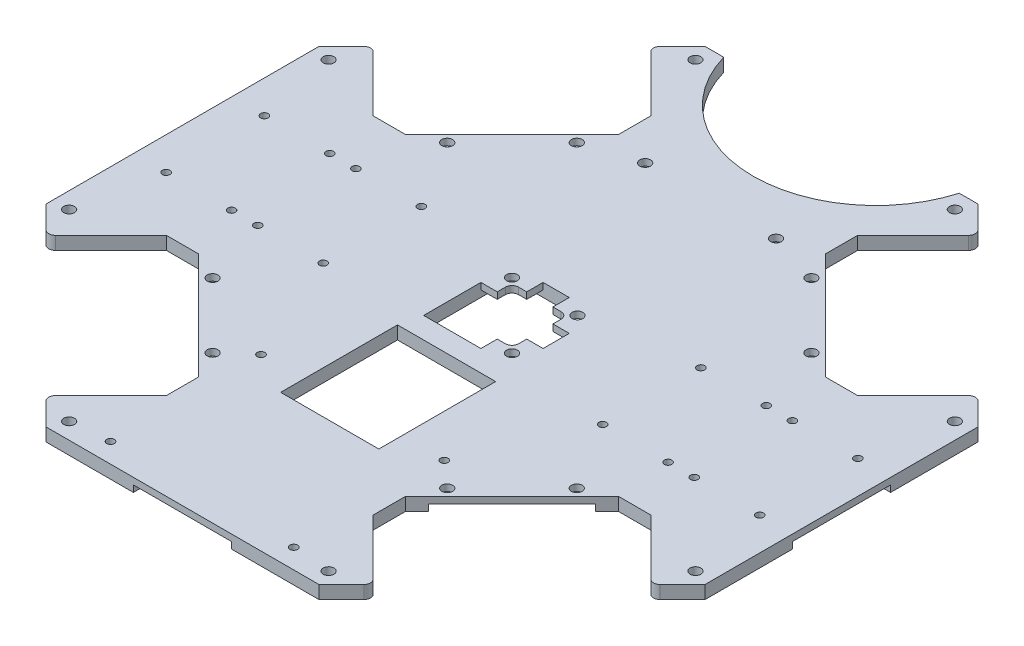
from build123d import *

# Parameters (mm, degrees)
BOSS_EXTRUDE1_DEPTH = 4
CUT_EXTRUDE1_REACH  = 144.472
SKETCH2_R           = 1.65
CUT_EXTRUDE2_REACH  = 144.472
SKETCH3_R           = 37.5
CHAMFER2_SIZE       = 7
CUT_EXTRUDE3_REACH  = 144.472
SKETCH4_R           = 1.65
CUT_EXTRUDE4_REACH  = 144.472
SKETCH5_R           = 1.15
CUT_EXTRUDE5_DEPTH  = 2
CUT_EXTRUDE6_DEPTH  = 2
CUT_EXTRUDE7_REACH  = 144.472
SKETCH8_R           = 1.65
CUT_EXTRUDE9_REACH  = 144.472
SKETCH10_W          = 8
SKETCH10_H          = 5
SKETCH10_W_2        = 5
SKETCH10_H_2        = 8
CUT_EXTRUDE10_REACH = 144.472
SKETCH11_R          = 1.65
CUT_EXTRUDE11_REACH = 144.472
SKETCH12_W          = 30
SKETCH12_H          = 35.702869044
SKETCH13_W          = 30
SKETCH13_H          = 40
SKETCH13_W_2        = 50
SKETCH13_H_2        = 30
SKETCH13_H_3        = 45
CUT_EXTRUDE12_DEPTH = 2
SKETCH15_R          = 4
CUT_EXTRUDE13_DEPTH = 2
CUT_EXTRUDE14_REACH = 144.472
SKETCH16_R          = 1.15
SKETCH17_R          = 2.5
CUT_EXTRUDE16_DEPTH = 2
SKETCH18_W          = 27
SKETCH18_H          = 27
CUT_EXTRUDE17_DEPTH = 2
CUT_EXTRUDE19_REACH = 144.429
SKETCH19_W          = 9.5
SKETCH19_H          = 9.5
CUT_EXTRUDE20_DEPTH = 2
FILLET1_R           = 2


with BuildPart() as part:
    # Sketch1 → Boss-Extrude1 (new body)
    with BuildSketch(Plane(origin=(0, 0, 0), x_dir=(1, 0, 0), z_dir=(0, 1, 0))):
        Polygon((-41.712494128, 100.702869044), (-100.702869044, 41.712494128), (-100.702869044, -41.712494128), (-41.712494128, -100.702869044), (41.712494128, -100.702869044), (100.702869044, -41.712494128), (100.702869044, 41.712494128), (41.712494128, 100.702869044), align=None)
    extrude(amount=BOSS_EXTRUDE1_DEPTH)

    # Sketch2 → Cut-Extrude1 (cut, up to next)
    with BuildSketch(Plane(origin=(0, 4, 0), x_dir=(1, 0, 0), z_dir=(0, 1, 0)), mode=Mode.PRIVATE) as cut_extrude1_sk1:
        with Locations(Location((-55.6513324, 35.852342526, 0), (0, 0, 270))):
            Circle(SKETCH2_R)
    cut_extrude1_tool1 = extrude(cut_extrude1_sk1.sketch, amount=-CUT_EXTRUDE1_REACH, mode=Mode.PRIVATE) & part.part
    # Sketch2 → Cut-Extrude1 (cut, up to next)
    with BuildSketch(Plane(origin=(0, 4, 0), x_dir=(1, 0, 0), z_dir=(0, 1, 0)), mode=Mode.PRIVATE) as cut_extrude1_sk2:
        with Locations(Location((-35.852342526, 55.6513324, 0), (0, 0, 270))):
            Circle(SKETCH2_R)
    cut_extrude1_tool2 = extrude(cut_extrude1_sk2.sketch, amount=-CUT_EXTRUDE1_REACH, mode=Mode.PRIVATE) & part.part
    # Sketch2 → Cut-Extrude1 (cut, up to next)
    with BuildSketch(Plane(origin=(0, 4, 0), x_dir=(1, 0, 0), z_dir=(0, 1, 0)), mode=Mode.PRIVATE) as cut_extrude1_sk3:
        with Locations(Location((55.6513324, 35.852342526, 0), (0, 0, 270))):
            Circle(SKETCH2_R)
    cut_extrude1_tool3 = extrude(cut_extrude1_sk3.sketch, amount=-CUT_EXTRUDE1_REACH, mode=Mode.PRIVATE) & part.part
    # Sketch2 → Cut-Extrude1 (cut, up to next)
    with BuildSketch(Plane(origin=(0, 4, 0), x_dir=(1, 0, 0), z_dir=(0, 1, 0)), mode=Mode.PRIVATE) as cut_extrude1_sk4:
        with Locations(Location((35.852342526, 55.6513324, 0), (0, 0, 270))):
            Circle(SKETCH2_R)
    cut_extrude1_tool4 = extrude(cut_extrude1_sk4.sketch, amount=-CUT_EXTRUDE1_REACH, mode=Mode.PRIVATE) & part.part
    # Sketch2 → Cut-Extrude1 (cut, up to next)
    with BuildSketch(Plane(origin=(0, 4, 0), x_dir=(1, 0, 0), z_dir=(0, 1, 0)), mode=Mode.PRIVATE) as cut_extrude1_sk5:
        with Locations(Location((35.852342526, -55.6513324, 0), (0, 0, 270))):
            Circle(SKETCH2_R)
    cut_extrude1_tool5 = extrude(cut_extrude1_sk5.sketch, amount=-CUT_EXTRUDE1_REACH, mode=Mode.PRIVATE) & part.part
    # Sketch2 → Cut-Extrude1 (cut, up to next)
    with BuildSketch(Plane(origin=(0, 4, 0), x_dir=(1, 0, 0), z_dir=(0, 1, 0)), mode=Mode.PRIVATE) as cut_extrude1_sk6:
        with Locations(Location((55.6513324, -35.852342526, 0), (0, 0, 270))):
            Circle(SKETCH2_R)
    cut_extrude1_tool6 = extrude(cut_extrude1_sk6.sketch, amount=-CUT_EXTRUDE1_REACH, mode=Mode.PRIVATE) & part.part
    # Sketch2 → Cut-Extrude1 (cut, up to next)
    with BuildSketch(Plane(origin=(0, 4, 0), x_dir=(1, 0, 0), z_dir=(0, 1, 0)), mode=Mode.PRIVATE) as cut_extrude1_sk7:
        with Locations(Location((-55.6513324, -35.852342526, 0), (0, 0, 270))):
            Circle(SKETCH2_R)
    cut_extrude1_tool7 = extrude(cut_extrude1_sk7.sketch, amount=-CUT_EXTRUDE1_REACH, mode=Mode.PRIVATE) & part.part
    # Sketch2 → Cut-Extrude1 (cut, up to next)
    with BuildSketch(Plane(origin=(0, 4, 0), x_dir=(1, 0, 0), z_dir=(0, 1, 0)), mode=Mode.PRIVATE) as cut_extrude1_sk8:
        with Locations(Location((-35.852342526, -55.6513324, 0), (0, 0, 270))):
            Circle(SKETCH2_R)
    cut_extrude1_tool8 = extrude(cut_extrude1_sk8.sketch, amount=-CUT_EXTRUDE1_REACH, mode=Mode.PRIVATE) & part.part
    # Sketch2 → Cut-Extrude1 (cut, up to next)
    with BuildSketch(Plane(origin=(0, 4, 0), x_dir=(1, 0, 0), z_dir=(0, 1, 0)), mode=Mode.PRIVATE) as cut_extrude1_sk9:
        Polygon((-92.420885021, 49.99447815), (-49.99447815, 92.420885021), (-26.659954371, 69.086361242), (-69.086361242, 26.659954371), align=None)
    cut_extrude1_tool9 = extrude(cut_extrude1_sk9.sketch, amount=-CUT_EXTRUDE1_REACH, mode=Mode.PRIVATE) & part.part
    # Sketch2 → Cut-Extrude1 (cut, up to next)
    with BuildSketch(Plane(origin=(0, 4, 0), x_dir=(1, 0, 0), z_dir=(0, 1, 0)), mode=Mode.PRIVATE) as cut_extrude1_sk10:
        Polygon((49.99447815, 92.420885021), (92.420885021, 49.99447815), (69.086361242, 26.659954371), (26.659954371, 69.086361242), align=None)
    cut_extrude1_tool10 = extrude(cut_extrude1_sk10.sketch, amount=-CUT_EXTRUDE1_REACH, mode=Mode.PRIVATE) & part.part
    # Sketch2 → Cut-Extrude1 (cut, up to next)
    with BuildSketch(Plane(origin=(0, 4, 0), x_dir=(1, 0, 0), z_dir=(0, 1, 0)), mode=Mode.PRIVATE) as cut_extrude1_sk11:
        Polygon((92.420885021, -49.99447815), (49.99447815, -92.420885021), (26.659954371, -69.086361242), (69.086361242, -26.659954371), align=None)
    cut_extrude1_tool11 = extrude(cut_extrude1_sk11.sketch, amount=-CUT_EXTRUDE1_REACH, mode=Mode.PRIVATE) & part.part
    # Sketch2 → Cut-Extrude1 (cut, up to next)
    with BuildSketch(Plane(origin=(0, 4, 0), x_dir=(1, 0, 0), z_dir=(0, 1, 0)), mode=Mode.PRIVATE) as cut_extrude1_sk12:
        Polygon((-49.99447815, -92.420885021), (-92.420885021, -49.99447815), (-69.086361242, -26.659954371), (-26.659954371, -69.086361242), align=None)
    cut_extrude1_tool12 = extrude(cut_extrude1_sk12.sketch, amount=-CUT_EXTRUDE1_REACH, mode=Mode.PRIVATE) & part.part
    add(cut_extrude1_tool1.solids().sort_by_distance((-55.651332, 4, -35.852343))[0], mode=Mode.SUBTRACT)
    add(cut_extrude1_tool2.solids().sort_by_distance((-35.852343, 4, -55.651332))[0], mode=Mode.SUBTRACT)
    add(cut_extrude1_tool3.solids().sort_by_distance((55.651332, 4, -35.852343))[0], mode=Mode.SUBTRACT)
    add(cut_extrude1_tool4.solids().sort_by_distance((35.852343, 4, -55.651332))[0], mode=Mode.SUBTRACT)
    add(cut_extrude1_tool5.solids().sort_by_distance((35.852343, 4, 55.651332))[0], mode=Mode.SUBTRACT)
    add(cut_extrude1_tool6.solids().sort_by_distance((55.651332, 4, 35.852343))[0], mode=Mode.SUBTRACT)
    add(cut_extrude1_tool7.solids().sort_by_distance((-55.651332, 4, 35.852343))[0], mode=Mode.SUBTRACT)
    add(cut_extrude1_tool8.solids().sort_by_distance((-35.852343, 4, 55.651332))[0], mode=Mode.SUBTRACT)
    add(cut_extrude1_tool9.solids().sort_by_distance((-59.54042, 4, -59.54042))[0], mode=Mode.SUBTRACT)
    add(cut_extrude1_tool10.solids().sort_by_distance((59.54042, 4, -59.54042))[0], mode=Mode.SUBTRACT)
    add(cut_extrude1_tool11.solids().sort_by_distance((59.54042, 4, 59.54042))[0], mode=Mode.SUBTRACT)
    add(cut_extrude1_tool12.solids().sort_by_distance((-59.54042, 4, 59.54042))[0], mode=Mode.SUBTRACT)

    # Sketch3 → Cut-Extrude2 (cut, up to next)
    with BuildSketch(Plane(origin=(0, 4, 0), x_dir=(1, 0, 0), z_dir=(0, 1, 0)), mode=Mode.PRIVATE) as cut_extrude2_sk1:
        with Locations((0, 111.202869044)):
            Circle(SKETCH3_R)
    cut_extrude2_tool1 = extrude(cut_extrude2_sk1.sketch, amount=-CUT_EXTRUDE2_REACH, mode=Mode.PRIVATE) & part.part
    add(cut_extrude2_tool1.solids().sort_by_distance((0, 4, -111.202869))[0], mode=Mode.SUBTRACT)

    # Chamfer2
    chamfer2_edges = [part.edges().sort_by_distance(p)[0] for p in [
        (69.086361242, 2, 26.659954371),
        (26.659954371, 2, 69.086361242),
        (26.659954371, 2, -69.086361242),
        (69.086361242, 2, -26.659954371),
        (-26.659954371, 2, 69.086361242),
        (-69.086361242, 2, 26.659954371),
        (-69.086361242, 2, -26.659954371),
        (-26.659954371, 2, -69.086361242),
    ]]
    chamfer(chamfer2_edges, length=CHAMFER2_SIZE)

    # Sketch4 → Cut-Extrude3 (cut, up to next)
    with BuildSketch(Plane(origin=(0, 4, 0), x_dir=(1, 0, 0), z_dir=(0, 1, 0)), mode=Mode.PRIVATE) as cut_extrude3_sk1:
        with Locations(Location((-39.641426316, 95.702869044, 0), (0, 0, 270))):
            Circle(SKETCH4_R)
    cut_extrude3_tool1 = extrude(cut_extrude3_sk1.sketch, amount=-CUT_EXTRUDE3_REACH, mode=Mode.PRIVATE) & part.part
    # Sketch4 → Cut-Extrude3 (cut, up to next)
    with BuildSketch(Plane(origin=(0, 4, 0), x_dir=(1, 0, 0), z_dir=(0, 1, 0)), mode=Mode.PRIVATE) as cut_extrude3_sk2:
        with Locations(Location((39.641426316, 95.702869044, 0), (0, 0, 270))):
            Circle(SKETCH4_R)
    cut_extrude3_tool2 = extrude(cut_extrude3_sk2.sketch, amount=-CUT_EXTRUDE3_REACH, mode=Mode.PRIVATE) & part.part
    # Sketch4 → Cut-Extrude3 (cut, up to next)
    with BuildSketch(Plane(origin=(0, 4, 0), x_dir=(1, 0, 0), z_dir=(0, 1, 0)), mode=Mode.PRIVATE) as cut_extrude3_sk3:
        with Locations(Location((95.702869044, 39.641426316, 0), (0, 0, 270))):
            Circle(SKETCH4_R)
    cut_extrude3_tool3 = extrude(cut_extrude3_sk3.sketch, amount=-CUT_EXTRUDE3_REACH, mode=Mode.PRIVATE) & part.part
    # Sketch4 → Cut-Extrude3 (cut, up to next)
    with BuildSketch(Plane(origin=(0, 4, 0), x_dir=(1, 0, 0), z_dir=(0, 1, 0)), mode=Mode.PRIVATE) as cut_extrude3_sk4:
        with Locations(Location((95.702869044, -39.641426316, 0), (0, 0, 270))):
            Circle(SKETCH4_R)
    cut_extrude3_tool4 = extrude(cut_extrude3_sk4.sketch, amount=-CUT_EXTRUDE3_REACH, mode=Mode.PRIVATE) & part.part
    # Sketch4 → Cut-Extrude3 (cut, up to next)
    with BuildSketch(Plane(origin=(0, 4, 0), x_dir=(1, 0, 0), z_dir=(0, 1, 0)), mode=Mode.PRIVATE) as cut_extrude3_sk5:
        with Locations(Location((39.641426316, -95.702869044, 0), (0, 0, 270))):
            Circle(SKETCH4_R)
    cut_extrude3_tool5 = extrude(cut_extrude3_sk5.sketch, amount=-CUT_EXTRUDE3_REACH, mode=Mode.PRIVATE) & part.part
    # Sketch4 → Cut-Extrude3 (cut, up to next)
    with BuildSketch(Plane(origin=(0, 4, 0), x_dir=(1, 0, 0), z_dir=(0, 1, 0)), mode=Mode.PRIVATE) as cut_extrude3_sk6:
        with Locations(Location((-39.641426316, -95.702869044, 0), (0, 0, 270))):
            Circle(SKETCH4_R)
    cut_extrude3_tool6 = extrude(cut_extrude3_sk6.sketch, amount=-CUT_EXTRUDE3_REACH, mode=Mode.PRIVATE) & part.part
    # Sketch4 → Cut-Extrude3 (cut, up to next)
    with BuildSketch(Plane(origin=(0, 4, 0), x_dir=(1, 0, 0), z_dir=(0, 1, 0)), mode=Mode.PRIVATE) as cut_extrude3_sk7:
        with Locations(Location((-95.702869044, -39.641426316, 0), (0, 0, 270))):
            Circle(SKETCH4_R)
    cut_extrude3_tool7 = extrude(cut_extrude3_sk7.sketch, amount=-CUT_EXTRUDE3_REACH, mode=Mode.PRIVATE) & part.part
    # Sketch4 → Cut-Extrude3 (cut, up to next)
    with BuildSketch(Plane(origin=(0, 4, 0), x_dir=(1, 0, 0), z_dir=(0, 1, 0)), mode=Mode.PRIVATE) as cut_extrude3_sk8:
        with Locations(Location((-95.702869044, 39.641426316, 0), (0, 0, 270))):
            Circle(SKETCH4_R)
    cut_extrude3_tool8 = extrude(cut_extrude3_sk8.sketch, amount=-CUT_EXTRUDE3_REACH, mode=Mode.PRIVATE) & part.part
    add(cut_extrude3_tool1.solids().sort_by_distance((-39.641426, 4, -95.702869))[0], mode=Mode.SUBTRACT)
    add(cut_extrude3_tool2.solids().sort_by_distance((39.641426, 4, -95.702869))[0], mode=Mode.SUBTRACT)
    add(cut_extrude3_tool3.solids().sort_by_distance((95.702869, 4, -39.641426))[0], mode=Mode.SUBTRACT)
    add(cut_extrude3_tool4.solids().sort_by_distance((95.702869, 4, 39.641426))[0], mode=Mode.SUBTRACT)
    add(cut_extrude3_tool5.solids().sort_by_distance((39.641426, 4, 95.702869))[0], mode=Mode.SUBTRACT)
    add(cut_extrude3_tool6.solids().sort_by_distance((-39.641426, 4, 95.702869))[0], mode=Mode.SUBTRACT)
    add(cut_extrude3_tool7.solids().sort_by_distance((-95.702869, 4, 39.641426))[0], mode=Mode.SUBTRACT)
    add(cut_extrude3_tool8.solids().sort_by_distance((-95.702869, 4, -39.641426))[0], mode=Mode.SUBTRACT)

    # Sketch5 → Cut-Extrude4 (cut, up to next)
    with BuildSketch(Plane(origin=(0, 4, 0), x_dir=(1, 0, 0), z_dir=(0, 1, 0)), mode=Mode.PRIVATE) as cut_extrude4_sk1:
        with Locations(Location((-90.702869044, 15, 0), (0, 0, 270))):
            Circle(SKETCH5_R)
    cut_extrude4_tool1 = extrude(cut_extrude4_sk1.sketch, amount=-CUT_EXTRUDE4_REACH, mode=Mode.PRIVATE) & part.part
    # Sketch5 → Cut-Extrude4 (cut, up to next)
    with BuildSketch(Plane(origin=(0, 4, 0), x_dir=(1, 0, 0), z_dir=(0, 1, 0)), mode=Mode.PRIVATE) as cut_extrude4_sk2:
        with Locations(Location((-70.702869044, 15, 0), (0, 0, 270))):
            Circle(SKETCH5_R)
    cut_extrude4_tool2 = extrude(cut_extrude4_sk2.sketch, amount=-CUT_EXTRUDE4_REACH, mode=Mode.PRIVATE) & part.part
    # Sketch5 → Cut-Extrude4 (cut, up to next)
    with BuildSketch(Plane(origin=(0, 4, 0), x_dir=(1, 0, 0), z_dir=(0, 1, 0)), mode=Mode.PRIVATE) as cut_extrude4_sk3:
        with Locations(Location((-62.702869044, 15, 0), (0, 0, 270))):
            Circle(SKETCH5_R)
    cut_extrude4_tool3 = extrude(cut_extrude4_sk3.sketch, amount=-CUT_EXTRUDE4_REACH, mode=Mode.PRIVATE) & part.part
    # Sketch5 → Cut-Extrude4 (cut, up to next)
    with BuildSketch(Plane(origin=(0, 4, 0), x_dir=(1, 0, 0), z_dir=(0, 1, 0)), mode=Mode.PRIVATE) as cut_extrude4_sk4:
        with Locations(Location((-42.702869044, 15, 0), (0, 0, 270))):
            Circle(SKETCH5_R)
    cut_extrude4_tool4 = extrude(cut_extrude4_sk4.sketch, amount=-CUT_EXTRUDE4_REACH, mode=Mode.PRIVATE) & part.part
    # Sketch5 → Cut-Extrude4 (cut, up to next)
    with BuildSketch(Plane(origin=(0, 4, 0), x_dir=(1, 0, 0), z_dir=(0, 1, 0)), mode=Mode.PRIVATE) as cut_extrude4_sk5:
        with Locations(Location((-42.702869044, -15, 0), (0, 0, 270))):
            Circle(SKETCH5_R)
    cut_extrude4_tool5 = extrude(cut_extrude4_sk5.sketch, amount=-CUT_EXTRUDE4_REACH, mode=Mode.PRIVATE) & part.part
    # Sketch5 → Cut-Extrude4 (cut, up to next)
    with BuildSketch(Plane(origin=(0, 4, 0), x_dir=(1, 0, 0), z_dir=(0, 1, 0)), mode=Mode.PRIVATE) as cut_extrude4_sk6:
        with Locations(Location((-62.702869044, -15, 0), (0, 0, 270))):
            Circle(SKETCH5_R)
    cut_extrude4_tool6 = extrude(cut_extrude4_sk6.sketch, amount=-CUT_EXTRUDE4_REACH, mode=Mode.PRIVATE) & part.part
    # Sketch5 → Cut-Extrude4 (cut, up to next)
    with BuildSketch(Plane(origin=(0, 4, 0), x_dir=(1, 0, 0), z_dir=(0, 1, 0)), mode=Mode.PRIVATE) as cut_extrude4_sk7:
        with Locations(Location((-70.702869044, -15, 0), (0, 0, 270))):
            Circle(SKETCH5_R)
    cut_extrude4_tool7 = extrude(cut_extrude4_sk7.sketch, amount=-CUT_EXTRUDE4_REACH, mode=Mode.PRIVATE) & part.part
    # Sketch5 → Cut-Extrude4 (cut, up to next)
    with BuildSketch(Plane(origin=(0, 4, 0), x_dir=(1, 0, 0), z_dir=(0, 1, 0)), mode=Mode.PRIVATE) as cut_extrude4_sk8:
        with Locations(Location((-90.702869044, -15, 0), (0, 0, 270))):
            Circle(SKETCH5_R)
    cut_extrude4_tool8 = extrude(cut_extrude4_sk8.sketch, amount=-CUT_EXTRUDE4_REACH, mode=Mode.PRIVATE) & part.part
    # Sketch5 → Cut-Extrude4 (cut, up to next)
    with BuildSketch(Plane(origin=(0, 4, 0), x_dir=(1, 0, 0), z_dir=(0, 1, 0)), mode=Mode.PRIVATE) as cut_extrude4_sk9:
        with Locations(Location((90.702869044, -15, 0), (0, 0, 270))):
            Circle(SKETCH5_R)
    cut_extrude4_tool9 = extrude(cut_extrude4_sk9.sketch, amount=-CUT_EXTRUDE4_REACH, mode=Mode.PRIVATE) & part.part
    # Sketch5 → Cut-Extrude4 (cut, up to next)
    with BuildSketch(Plane(origin=(0, 4, 0), x_dir=(1, 0, 0), z_dir=(0, 1, 0)), mode=Mode.PRIVATE) as cut_extrude4_sk10:
        with Locations(Location((70.702869044, -15, 0), (0, 0, 270))):
            Circle(SKETCH5_R)
    cut_extrude4_tool10 = extrude(cut_extrude4_sk10.sketch, amount=-CUT_EXTRUDE4_REACH, mode=Mode.PRIVATE) & part.part
    # Sketch5 → Cut-Extrude4 (cut, up to next)
    with BuildSketch(Plane(origin=(0, 4, 0), x_dir=(1, 0, 0), z_dir=(0, 1, 0)), mode=Mode.PRIVATE) as cut_extrude4_sk11:
        with Locations(Location((62.702869044, -15, 0), (0, 0, 270))):
            Circle(SKETCH5_R)
    cut_extrude4_tool11 = extrude(cut_extrude4_sk11.sketch, amount=-CUT_EXTRUDE4_REACH, mode=Mode.PRIVATE) & part.part
    # Sketch5 → Cut-Extrude4 (cut, up to next)
    with BuildSketch(Plane(origin=(0, 4, 0), x_dir=(1, 0, 0), z_dir=(0, 1, 0)), mode=Mode.PRIVATE) as cut_extrude4_sk12:
        with Locations(Location((42.702869044, -15, 0), (0, 0, 270))):
            Circle(SKETCH5_R)
    cut_extrude4_tool12 = extrude(cut_extrude4_sk12.sketch, amount=-CUT_EXTRUDE4_REACH, mode=Mode.PRIVATE) & part.part
    # Sketch5 → Cut-Extrude4 (cut, up to next)
    with BuildSketch(Plane(origin=(0, 4, 0), x_dir=(1, 0, 0), z_dir=(0, 1, 0)), mode=Mode.PRIVATE) as cut_extrude4_sk13:
        with Locations(Location((42.702869044, 15, 0), (0, 0, 270))):
            Circle(SKETCH5_R)
    cut_extrude4_tool13 = extrude(cut_extrude4_sk13.sketch, amount=-CUT_EXTRUDE4_REACH, mode=Mode.PRIVATE) & part.part
    # Sketch5 → Cut-Extrude4 (cut, up to next)
    with BuildSketch(Plane(origin=(0, 4, 0), x_dir=(1, 0, 0), z_dir=(0, 1, 0)), mode=Mode.PRIVATE) as cut_extrude4_sk14:
        with Locations(Location((62.702869044, 15, 0), (0, 0, 270))):
            Circle(SKETCH5_R)
    cut_extrude4_tool14 = extrude(cut_extrude4_sk14.sketch, amount=-CUT_EXTRUDE4_REACH, mode=Mode.PRIVATE) & part.part
    # Sketch5 → Cut-Extrude4 (cut, up to next)
    with BuildSketch(Plane(origin=(0, 4, 0), x_dir=(1, 0, 0), z_dir=(0, 1, 0)), mode=Mode.PRIVATE) as cut_extrude4_sk15:
        with Locations(Location((70.702869044, 15, 0), (0, 0, 270))):
            Circle(SKETCH5_R)
    cut_extrude4_tool15 = extrude(cut_extrude4_sk15.sketch, amount=-CUT_EXTRUDE4_REACH, mode=Mode.PRIVATE) & part.part
    # Sketch5 → Cut-Extrude4 (cut, up to next)
    with BuildSketch(Plane(origin=(0, 4, 0), x_dir=(1, 0, 0), z_dir=(0, 1, 0)), mode=Mode.PRIVATE) as cut_extrude4_sk16:
        with Locations(Location((90.702869044, 15, 0), (0, 0, 270))):
            Circle(SKETCH5_R)
    cut_extrude4_tool16 = extrude(cut_extrude4_sk16.sketch, amount=-CUT_EXTRUDE4_REACH, mode=Mode.PRIVATE) & part.part
    add(cut_extrude4_tool1.solids().sort_by_distance((-90.702869, 4, -15))[0], mode=Mode.SUBTRACT)
    add(cut_extrude4_tool2.solids().sort_by_distance((-70.702869, 4, -15))[0], mode=Mode.SUBTRACT)
    add(cut_extrude4_tool3.solids().sort_by_distance((-62.702869, 4, -15))[0], mode=Mode.SUBTRACT)
    add(cut_extrude4_tool4.solids().sort_by_distance((-42.702869, 4, -15))[0], mode=Mode.SUBTRACT)
    add(cut_extrude4_tool5.solids().sort_by_distance((-42.702869, 4, 15))[0], mode=Mode.SUBTRACT)
    add(cut_extrude4_tool6.solids().sort_by_distance((-62.702869, 4, 15))[0], mode=Mode.SUBTRACT)
    add(cut_extrude4_tool7.solids().sort_by_distance((-70.702869, 4, 15))[0], mode=Mode.SUBTRACT)
    add(cut_extrude4_tool8.solids().sort_by_distance((-90.702869, 4, 15))[0], mode=Mode.SUBTRACT)
    add(cut_extrude4_tool9.solids().sort_by_distance((90.702869, 4, 15))[0], mode=Mode.SUBTRACT)
    add(cut_extrude4_tool10.solids().sort_by_distance((70.702869, 4, 15))[0], mode=Mode.SUBTRACT)
    add(cut_extrude4_tool11.solids().sort_by_distance((62.702869, 4, 15))[0], mode=Mode.SUBTRACT)
    add(cut_extrude4_tool12.solids().sort_by_distance((42.702869, 4, 15))[0], mode=Mode.SUBTRACT)
    add(cut_extrude4_tool13.solids().sort_by_distance((42.702869, 4, -15))[0], mode=Mode.SUBTRACT)
    add(cut_extrude4_tool14.solids().sort_by_distance((62.702869, 4, -15))[0], mode=Mode.SUBTRACT)
    add(cut_extrude4_tool15.solids().sort_by_distance((70.702869, 4, -15))[0], mode=Mode.SUBTRACT)
    add(cut_extrude4_tool16.solids().sort_by_distance((90.702869, 4, -15))[0], mode=Mode.SUBTRACT)

    # Sketch6 → Cut-Extrude5 (cut)
    with BuildSketch(Plane.XZ):
        Polygon((-89.461565965, 17.15), (-91.944172122, 17.15), (-93.185475201, 15), (-91.944172122, 12.85), (-89.461565965, 12.85), (-88.220262886, 15), align=None)
        Polygon((-73.185475201, 15), (-71.944172122, 12.85), (-69.461565965, 12.85), (-68.220262886, 15), (-69.461565965, 17.15), (-71.944172122, 17.15), align=None)
        Polygon((-63.944172122, 17.15), (-65.185475201, 15), (-63.944172122, 12.85), (-61.461565965, 12.85), (-60.220262886, 15), (-61.461565965, 17.15), align=None)
        Polygon((-43.944172122, 17.15), (-45.185475201, 15), (-43.944172122, 12.85), (-41.461565965, 12.85), (-40.220262886, 15), (-41.461565965, 17.15), align=None)
        Polygon((-91.944172122, -12.85), (-93.185475201, -15), (-91.944172122, -17.15), (-89.461565965, -17.15), (-88.220262886, -15), (-89.461565965, -12.85), align=None)
        Polygon((-73.185475201, -15), (-71.944172122, -17.15), (-69.461565965, -17.15), (-68.220262886, -15), (-69.461565965, -12.85), (-71.944172122, -12.85), align=None)
        Polygon((-63.944172122, -12.85), (-65.185475201, -15), (-63.944172122, -17.15), (-61.461565965, -17.15), (-60.220262886, -15), (-61.461565965, -12.85), align=None)
        Polygon((-43.944172122, -12.85), (-45.185475201, -15), (-43.944172122, -17.15), (-41.461565965, -17.15), (-40.220262886, -15), (-41.461565965, -12.85), align=None)
        Polygon((41.461565965, -12.85), (43.944172122, -12.85), (45.185475201, -15), (43.944172122, -17.15), (41.461565965, -17.15), (40.220262886, -15), align=None)
        Polygon((61.461565965, -12.85), (63.944172122, -12.85), (65.185475201, -15), (63.944172122, -17.15), (61.461565965, -17.15), (60.220262886, -15), align=None)
        Polygon((71.944172122, -12.85), (73.185475201, -15), (71.944172122, -17.15), (69.461565965, -17.15), (68.220262886, -15), (69.461565965, -12.85), align=None)
        Polygon((89.461565965, -12.85), (91.944172122, -12.85), (93.185475201, -15), (91.944172122, -17.15), (89.461565965, -17.15), (88.220262886, -15), align=None)
        Polygon((41.461565965, 17.15), (43.944172122, 17.15), (45.185475201, 15), (43.944172122, 12.85), (41.461565965, 12.85), (40.220262886, 15), align=None)
        Polygon((61.461565965, 17.15), (63.944172122, 17.15), (65.185475201, 15), (63.944172122, 12.85), (61.461565965, 12.85), (60.220262886, 15), align=None)
        Polygon((71.944172122, 17.15), (73.185475201, 15), (71.944172122, 12.85), (69.461565965, 12.85), (68.220262886, 15), (69.461565965, 17.15), align=None)
        Polygon((88.220262886, 15), (89.461565965, 17.15), (91.944172122, 17.15), (93.185475201, 15), (91.944172122, 12.85), (89.461565965, 12.85), align=None)
    extrude(amount=-CUT_EXTRUDE5_DEPTH, mode=Mode.SUBTRACT)

    # Sketch7 → Cut-Extrude6 (cut)
    with BuildSketch(Plane.XZ):
        Polygon((-60.601079868, -35.145235745), (-54.944225618, -40.802089995), (-45.044730682, -30.902595058), (-50.701584931, -25.245740809), align=None)
        Polygon((-40.802089995, -54.944225618), (-30.902595058, -45.044730682), (-25.245740809, -50.701584931), (-35.145235745, -60.601079868), align=None)
        Polygon((-35.145235745, 60.601079868), (-40.802089995, 54.944225618), (-30.902595058, 45.044730682), (-25.245740809, 50.701584931), align=None)
        Polygon((-54.944225618, 40.802089995), (-45.044730682, 30.902595058), (-50.701584931, 25.245740809), (-60.601079868, 35.145235745), align=None)
        Polygon((60.601079868, 35.145235745), (54.944225618, 40.802089995), (45.044730682, 30.902595058), (50.701584931, 25.245740809), align=None)
        Polygon((40.802089995, 54.944225618), (30.902595058, 45.044730682), (25.245740809, 50.701584931), (35.145235745, 60.601079868), align=None)
        Polygon((35.145235745, -60.601079868), (40.802089995, -54.944225618), (30.902595058, -45.044730682), (25.245740809, -50.701584931), align=None)
        Polygon((54.944225618, -40.802089995), (45.044730682, -30.902595058), (50.701584931, -25.245740809), (60.601079868, -35.145235745), align=None)
    extrude(amount=-CUT_EXTRUDE6_DEPTH, mode=Mode.SUBTRACT)

    # Sketch8 → Cut-Extrude7 (cut, up to next)
    with BuildSketch(Plane(origin=(0, 4, 0), x_dir=(1, 0, 0), z_dir=(0, 1, 0)), mode=Mode.PRIVATE) as cut_extrude7_sk1:
        with Locations(Location((-10, -10, 0), (0, 0, 270))):
            Circle(SKETCH8_R)
    cut_extrude7_tool1 = extrude(cut_extrude7_sk1.sketch, amount=-CUT_EXTRUDE7_REACH, mode=Mode.PRIVATE) & part.part
    # Sketch8 → Cut-Extrude7 (cut, up to next)
    with BuildSketch(Plane(origin=(0, 4, 0), x_dir=(1, 0, 0), z_dir=(0, 1, 0)), mode=Mode.PRIVATE) as cut_extrude7_sk2:
        with Locations(Location((10, -10, 0), (0, 0, 270))):
            Circle(SKETCH8_R)
    cut_extrude7_tool2 = extrude(cut_extrude7_sk2.sketch, amount=-CUT_EXTRUDE7_REACH, mode=Mode.PRIVATE) & part.part
    # Sketch8 → Cut-Extrude7 (cut, up to next)
    with BuildSketch(Plane(origin=(0, 4, 0), x_dir=(1, 0, 0), z_dir=(0, 1, 0)), mode=Mode.PRIVATE) as cut_extrude7_sk3:
        with Locations(Location((10, 10, 0), (0, 0, 270))):
            Circle(SKETCH8_R)
    cut_extrude7_tool3 = extrude(cut_extrude7_sk3.sketch, amount=-CUT_EXTRUDE7_REACH, mode=Mode.PRIVATE) & part.part
    # Sketch8 → Cut-Extrude7 (cut, up to next)
    with BuildSketch(Plane(origin=(0, 4, 0), x_dir=(1, 0, 0), z_dir=(0, 1, 0)), mode=Mode.PRIVATE) as cut_extrude7_sk4:
        with Locations(Location((-10, 10, 0), (0, 0, 270))):
            Circle(SKETCH8_R)
    cut_extrude7_tool4 = extrude(cut_extrude7_sk4.sketch, amount=-CUT_EXTRUDE7_REACH, mode=Mode.PRIVATE) & part.part
    # Sketch8 → Cut-Extrude7 (cut, up to next)
    with BuildSketch(Plane(origin=(0, 4, 0), x_dir=(1, 0, 0), z_dir=(0, 1, 0)), mode=Mode.PRIVATE) as cut_extrude7_sk5:
        with BuildLine():
            Line((-6.5, 8.5), (6.5, 8.5))
            ThreePointArc((6.5, 8.5), (7.914213562, 7.914213562), (8.5, 6.5))
            Line((8.5, 6.5), (8.5, -6.5))
            ThreePointArc((8.5, -6.5), (7.914213562, -7.914213562), (6.5, -8.5))
            Line((6.5, -8.5), (-6.5, -8.5))
            ThreePointArc((-6.5, -8.5), (-7.914213562, -7.914213562), (-8.5, -6.5))
            Line((-8.5, -6.5), (-8.5, 6.5))
            ThreePointArc((-8.5, 6.5), (-7.914213562, 7.914213562), (-6.5, 8.5))
        make_face()
    cut_extrude7_tool5 = extrude(cut_extrude7_sk5.sketch, amount=-CUT_EXTRUDE7_REACH, mode=Mode.PRIVATE) & part.part
    add(cut_extrude7_tool1.solids().sort_by_distance((-10, 4, 10))[0], mode=Mode.SUBTRACT)
    add(cut_extrude7_tool2.solids().sort_by_distance((10, 4, 10))[0], mode=Mode.SUBTRACT)
    add(cut_extrude7_tool3.solids().sort_by_distance((10, 4, -10))[0], mode=Mode.SUBTRACT)
    add(cut_extrude7_tool4.solids().sort_by_distance((-10, 4, -10))[0], mode=Mode.SUBTRACT)
    add(cut_extrude7_tool5.solids().sort_by_distance((0, 4, 0))[0], mode=Mode.SUBTRACT)

    # Sketch10 → Cut-Extrude9 (cut, up to next)
    with BuildSketch(Plane.XZ, mode=Mode.PRIVATE) as cut_extrude9_sk1:
        with Locations((0, 11)):
            Rectangle(SKETCH10_W, SKETCH10_H)
    cut_extrude9_tool1 = extrude(cut_extrude9_sk1.sketch, amount=-CUT_EXTRUDE9_REACH, mode=Mode.PRIVATE) & part.part
    # Sketch10 → Cut-Extrude9 (cut, up to next)
    with BuildSketch(Plane.XZ, mode=Mode.PRIVATE) as cut_extrude9_sk2:
        with Locations((11, 0)):
            Rectangle(SKETCH10_W_2, SKETCH10_H_2)
    cut_extrude9_tool2 = extrude(cut_extrude9_sk2.sketch, amount=-CUT_EXTRUDE9_REACH, mode=Mode.PRIVATE) & part.part
    # Sketch10 → Cut-Extrude9 (cut, up to next)
    with BuildSketch(Plane.XZ, mode=Mode.PRIVATE) as cut_extrude9_sk3:
        with Locations((0, -11)):
            Rectangle(SKETCH10_W, SKETCH10_H)
    cut_extrude9_tool3 = extrude(cut_extrude9_sk3.sketch, amount=-CUT_EXTRUDE9_REACH, mode=Mode.PRIVATE) & part.part
    # Sketch10 → Cut-Extrude9 (cut, up to next)
    with BuildSketch(Plane.XZ, mode=Mode.PRIVATE) as cut_extrude9_sk4:
        with Locations((-11, 0)):
            Rectangle(SKETCH10_W_2, SKETCH10_H_2)
    cut_extrude9_tool4 = extrude(cut_extrude9_sk4.sketch, amount=-CUT_EXTRUDE9_REACH, mode=Mode.PRIVATE) & part.part
    add(cut_extrude9_tool1.solids().sort_by_distance((0, 0, 11))[0], mode=Mode.SUBTRACT)
    add(cut_extrude9_tool2.solids().sort_by_distance((11, 0, 0))[0], mode=Mode.SUBTRACT)
    add(cut_extrude9_tool3.solids().sort_by_distance((0, 0, -11))[0], mode=Mode.SUBTRACT)
    add(cut_extrude9_tool4.solids().sort_by_distance((-11, 0, 0))[0], mode=Mode.SUBTRACT)

    # Sketch11 → Cut-Extrude10 (cut, up to next)
    with BuildSketch(Plane.XZ, mode=Mode.PRIVATE) as cut_extrude10_sk1:
        with Locations(Location((-20, -60.702869044, 0), (0, 0, 270))):
            Circle(SKETCH11_R)
    cut_extrude10_tool1 = extrude(cut_extrude10_sk1.sketch, amount=-CUT_EXTRUDE10_REACH, mode=Mode.PRIVATE) & part.part
    # Sketch11 → Cut-Extrude10 (cut, up to next)
    with BuildSketch(Plane.XZ, mode=Mode.PRIVATE) as cut_extrude10_sk2:
        with Locations(Location((20, -60.702869044, 0), (0, 0, 270))):
            Circle(SKETCH11_R)
    cut_extrude10_tool2 = extrude(cut_extrude10_sk2.sketch, amount=-CUT_EXTRUDE10_REACH, mode=Mode.PRIVATE) & part.part
    add(cut_extrude10_tool1.solids().sort_by_distance((-20, 0, -60.702869))[0], mode=Mode.SUBTRACT)
    add(cut_extrude10_tool2.solids().sort_by_distance((20, 0, -60.702869))[0], mode=Mode.SUBTRACT)

    # Sketch12 → Cut-Extrude11 (cut, up to next)
    with BuildSketch(Plane(origin=(0, 4, 0), x_dir=(1, 0, 0), z_dir=(0, 1, 0)), mode=Mode.PRIVATE) as cut_extrude11_sk1:
        with Locations((0, -37.851434522)):
            Rectangle(SKETCH12_W, SKETCH12_H)
    cut_extrude11_tool1 = extrude(cut_extrude11_sk1.sketch, amount=-CUT_EXTRUDE11_REACH, mode=Mode.PRIVATE) & part.part
    add(cut_extrude11_tool1.solids().sort_by_distance((0, 4, 37.851435))[0], mode=Mode.SUBTRACT)

    # Sketch13 → Cut-Extrude12 (cut)
    with BuildSketch(Plane(origin=(0, 0, 0), x_dir=(-1, 0, 0), z_dir=(0, -1, 0))):
        with Locations((0, 56.833551332)):
            Rectangle(SKETCH13_W, SKETCH13_H)
        with Locations((75.702869044, 0)):
            Rectangle(SKETCH13_W_2, SKETCH13_H_2)
        with Locations((-75.702869044, 0)):
            Rectangle(SKETCH13_W_2, SKETCH13_H_2)
        with Locations((0, -78.202869044)):
            Rectangle(SKETCH13_W, SKETCH13_H_3)
    extrude(amount=-CUT_EXTRUDE12_DEPTH, mode=Mode.SUBTRACT)

    # Sketch15 → Cut-Extrude13 (cut)
    with BuildSketch(Plane.XZ):
        with Locations(Location((-20, -60.702869044, 0), (0, 0, 270))):
            Circle(SKETCH15_R)
        with Locations(Location((20, -60.702869044, 0), (0, 0, 270))):
            Circle(SKETCH15_R)
    extrude(amount=-CUT_EXTRUDE13_DEPTH, mode=Mode.SUBTRACT)

    # Sketch16 → Cut-Extrude14 (cut, up to next)
    with BuildSketch(Plane(origin=(0, 4, 0), x_dir=(1, 0, 0), z_dir=(0, 1, 0)), mode=Mode.PRIVATE) as cut_extrude14_sk1:
        with Locations(Location((-28, -48.702869044, 0), (0, 0, 270))):
            Circle(SKETCH16_R)
    cut_extrude14_tool1 = extrude(cut_extrude14_sk1.sketch, amount=-CUT_EXTRUDE14_REACH, mode=Mode.PRIVATE) & part.part
    # Sketch16 → Cut-Extrude14 (cut, up to next)
    with BuildSketch(Plane(origin=(0, 4, 0), x_dir=(1, 0, 0), z_dir=(0, 1, 0)), mode=Mode.PRIVATE) as cut_extrude14_sk2:
        with Locations(Location((28, -48.702869044, 0), (0, 0, 270))):
            Circle(SKETCH16_R)
    cut_extrude14_tool2 = extrude(cut_extrude14_sk2.sketch, amount=-CUT_EXTRUDE14_REACH, mode=Mode.PRIVATE) & part.part
    # Sketch16 → Cut-Extrude14 (cut, up to next)
    with BuildSketch(Plane(origin=(0, 4, 0), x_dir=(1, 0, 0), z_dir=(0, 1, 0)), mode=Mode.PRIVATE) as cut_extrude14_sk3:
        with Locations(Location((28, -94.702869044, 0), (0, 0, 270))):
            Circle(SKETCH16_R)
    cut_extrude14_tool3 = extrude(cut_extrude14_sk3.sketch, amount=-CUT_EXTRUDE14_REACH, mode=Mode.PRIVATE) & part.part
    # Sketch16 → Cut-Extrude14 (cut, up to next)
    with BuildSketch(Plane(origin=(0, 4, 0), x_dir=(1, 0, 0), z_dir=(0, 1, 0)), mode=Mode.PRIVATE) as cut_extrude14_sk4:
        with Locations(Location((-28, -94.702869044, 0), (0, 0, 270))):
            Circle(SKETCH16_R)
    cut_extrude14_tool4 = extrude(cut_extrude14_sk4.sketch, amount=-CUT_EXTRUDE14_REACH, mode=Mode.PRIVATE) & part.part
    add(cut_extrude14_tool1.solids().sort_by_distance((-28, 4, 48.702869))[0], mode=Mode.SUBTRACT)
    add(cut_extrude14_tool2.solids().sort_by_distance((28, 4, 48.702869))[0], mode=Mode.SUBTRACT)
    add(cut_extrude14_tool3.solids().sort_by_distance((28, 4, 94.702869))[0], mode=Mode.SUBTRACT)
    add(cut_extrude14_tool4.solids().sort_by_distance((-28, 4, 94.702869))[0], mode=Mode.SUBTRACT)

    # Sketch17 → Cut-Extrude16 (cut)
    with BuildSketch(Plane.XZ):
        with Locations(Location((-28, 94.702869044, 0), (0, 0, 270))):
            Circle(SKETCH17_R)
        with Locations(Location((28, 94.702869044, 0), (0, 0, 270))):
            Circle(SKETCH17_R)
        with Locations((28, 48.702869044)):
            Circle(SKETCH17_R)
        with Locations((-28, 48.702869044)):
            Circle(SKETCH17_R)
    extrude(amount=-CUT_EXTRUDE16_DEPTH, mode=Mode.SUBTRACT)

    # Sketch18 → Cut-Extrude17 (cut)
    with BuildSketch(Plane(origin=(0, 0, 0), x_dir=(-1, 0, 0), z_dir=(0, -1, 0))):
        Rectangle(SKETCH18_W, SKETCH18_H)
    extrude(amount=-CUT_EXTRUDE17_DEPTH, mode=Mode.SUBTRACT)

    # Sketch19 → Cut-Extrude19 (cut, up to next)
    with BuildSketch(Plane.XZ.offset(-2), mode=Mode.PRIVATE) as cut_extrude19_sk1:
        with Locations((-8.75, 8.75)):
            Rectangle(SKETCH19_W, SKETCH19_H)
    cut_extrude19_tool1 = extrude(cut_extrude19_sk1.sketch, amount=-CUT_EXTRUDE19_REACH, mode=Mode.PRIVATE) & part.part
    add(cut_extrude19_tool1.solids().sort_by_distance((-8.75, 2, 8.75))[0], mode=Mode.SUBTRACT)

    # Sketch20 → Cut-Extrude20 (cut)
    with BuildSketch(Plane.XZ):
        Polygon((-54.944225618, 40.802089995), (-33.731022183, 19.588886559), (-19.588886559, 33.731022183), (-40.802089995, 54.944225618), align=None)
        Polygon((40.802089995, 54.944225618), (19.588886559, 33.731022183), (33.731022183, 19.588886559), (54.944225618, 40.802089995), align=None)
        Polygon((54.944225618, -40.802089995), (33.731022183, -19.588886559), (19.588886559, -33.731022183), (40.802089995, -54.944225618), align=None)
        Polygon((-40.802089995, -54.944225618), (-19.588886559, -33.731022183), (-33.731022183, -19.588886559), (-54.944225618, -40.802089995), align=None)
    extrude(amount=-CUT_EXTRUDE20_DEPTH, mode=Mode.SUBTRACT)

    # Fillet1
    fillet1_edges = [part.edges().sort_by_distance(p)[0] for p in [
        (92.420885021, 2, 49.99447815),
        (49.99447815, 2, 92.420885021),
        (49.99447815, 2, -92.420885021),
        (92.420885021, 2, -49.99447815),
        (-49.99447815, 2, 92.420885021),
        (-92.420885021, 2, 49.99447815),
        (-92.420885021, 2, -49.99447815),
        (-49.99447815, 2, -92.420885021),
    ]]
    fillet(fillet1_edges, radius=FILLET1_R)


solid = part.part
